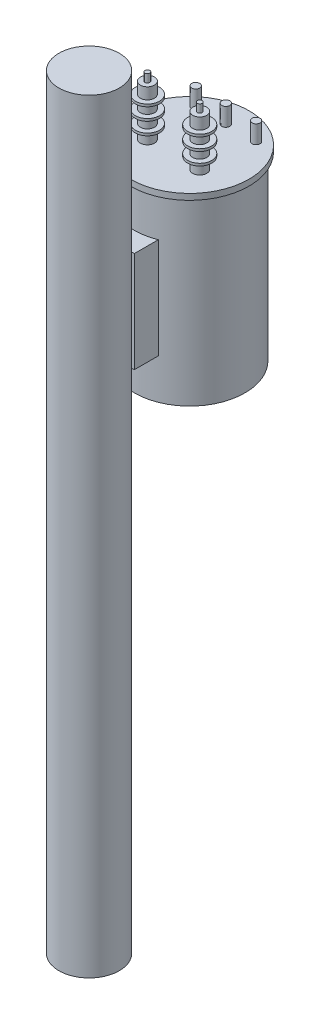
from build123d import *

# Parameters (mm, degrees)
SKETCH1_R           = 275
TANK_DEPTH          = 900
LID_START           = 900
SKETCH2_R           = 295
LID_DEPTH           = 30
POLE_START          = -2300
SKETCH3_R           = 150
POLE_DEPTH          = 3800
BUSHING_START       = 930
SKETCH4_R           = 35
BUSHING_HV_1_DEPTH  = 250
SHED_START          = 986.5
SKETCH5_R           = 60
SHED_HV_1_1_DEPTH   = 12
SHED_START_2        = 1049
SKETCH6_R           = 60
SHED_HV_1_2_DEPTH   = 12
SHED_START_3        = 1111.5
SKETCH7_R           = 60
SHED_HV_1_3_DEPTH   = 12
TERMINAL_START      = 1180
SKETCH8_R           = 12
TERMINAL_HV_1_DEPTH = 40
SKETCH9_R           = 35
BUSHING_HV_2_DEPTH  = 250
SKETCH10_R          = 60
SHED_HV_2_1_DEPTH   = 12
SKETCH11_R          = 60
SHED_HV_2_2_DEPTH   = 12
SKETCH12_R          = 60
SHED_HV_2_3_DEPTH   = 12
SKETCH13_R          = 12
TERMINAL_HV_2_DEPTH = 40
LV_START            = 930
SKETCH14_R          = 20
LV_BUSHING_1_DEPTH  = 90
SKETCH15_R          = 20
LV_BUSHING_2_DEPTH  = 90
SKETCH16_R          = 20
LV_BUSHING_3_DEPTH  = 90
HANGER_START        = 200
SKETCH17_W          = 200
SKETCH17_H          = 125
HANGER_DEPTH        = 500


with BuildPart() as part:
    # Sketch1 → Tank (new body)
    with BuildSketch(Plane(origin=(0, 0, 0), x_dir=(1, 0, 0), z_dir=(0, 1, 0))):
        with Locations(Location((0, 0, 0), (0, 0, 270))):
            Circle(SKETCH1_R)
    extrude(amount=TANK_DEPTH)


with BuildPart() as body_2:
    # Sketch2 → Lid (new body)
    with BuildSketch(Plane(origin=(0, 0, 0), x_dir=(1, 0, 0), z_dir=(0, 1, 0)).offset(LID_START)):
        with Locations(Location((0, 0, 0), (0, 0, 270))):
            Circle(SKETCH2_R)
    extrude(amount=LID_DEPTH)


with BuildPart() as body_3:
    # Sketch3 → Pole (new body)
    with BuildSketch(Plane(origin=(0, 0, 0), x_dir=(1, 0, 0), z_dir=(0, 1, 0)).offset(POLE_START)):
        with Locations(Location((0, -500, 0), (0, 0, 90))):
            Circle(SKETCH3_R)
    extrude(amount=POLE_DEPTH)


with BuildPart() as body_4:
    # Sketch4 → Bushing HV 1 (new body)
    with BuildSketch(Plane(origin=(0, 0, 0), x_dir=(1, 0, 0), z_dir=(0, 1, 0)).offset(BUSHING_START)):
        with Locations(Location((-130, -80, 0), (0, 0, 270))):
            Circle(SKETCH4_R)
    extrude(amount=BUSHING_HV_1_DEPTH)


with BuildPart() as body_5:
    # Sketch5 → Shed HV 1 1 (new body)
    with BuildSketch(Plane(origin=(0, 0, 0), x_dir=(1, 0, 0), z_dir=(0, 1, 0)).offset(SHED_START)):
        with Locations(Location((-130, -80, 0), (0, 0, 270))):
            Circle(SKETCH5_R)
    extrude(amount=SHED_HV_1_1_DEPTH)


with BuildPart() as body_6:
    # Sketch6 → Shed HV 1 2 (new body)
    with BuildSketch(Plane(origin=(0, 0, 0), x_dir=(1, 0, 0), z_dir=(0, 1, 0)).offset(SHED_START_2)):
        with Locations(Location((-130, -80, 0), (0, 0, 270))):
            Circle(SKETCH6_R)
    extrude(amount=SHED_HV_1_2_DEPTH)


with BuildPart() as body_7:
    # Sketch7 → Shed HV 1 3 (new body)
    with BuildSketch(Plane(origin=(0, 0, 0), x_dir=(1, 0, 0), z_dir=(0, 1, 0)).offset(SHED_START_3)):
        with Locations(Location((-130, -80, 0), (0, 0, 270))):
            Circle(SKETCH7_R)
    extrude(amount=SHED_HV_1_3_DEPTH)


with BuildPart() as body_8:
    # Sketch8 → Terminal HV 1 (new body)
    with BuildSketch(Plane(origin=(0, 0, 0), x_dir=(1, 0, 0), z_dir=(0, 1, 0)).offset(TERMINAL_START)):
        with Locations(Location((-130, -80, 0), (0, 0, 270))):
            Circle(SKETCH8_R)
    extrude(amount=TERMINAL_HV_1_DEPTH)


with BuildPart() as body_9:
    # Sketch9 → Bushing HV 2 (new body)
    with BuildSketch(Plane(origin=(0, 0, 0), x_dir=(1, 0, 0), z_dir=(0, 1, 0)).offset(BUSHING_START)):
        with Locations(Location((130, -80, 0), (0, 0, 270))):
            Circle(SKETCH9_R)
    extrude(amount=BUSHING_HV_2_DEPTH)


with BuildPart() as body_10:
    # Sketch10 → Shed HV 2 1 (new body)
    with BuildSketch(Plane(origin=(0, 0, 0), x_dir=(1, 0, 0), z_dir=(0, 1, 0)).offset(SHED_START)):
        with Locations(Location((130, -80, 0), (0, 0, 270))):
            Circle(SKETCH10_R)
    extrude(amount=SHED_HV_2_1_DEPTH)


with BuildPart() as body_11:
    # Sketch11 → Shed HV 2 2 (new body)
    with BuildSketch(Plane(origin=(0, 0, 0), x_dir=(1, 0, 0), z_dir=(0, 1, 0)).offset(SHED_START_2)):
        with Locations(Location((130, -80, 0), (0, 0, 270))):
            Circle(SKETCH11_R)
    extrude(amount=SHED_HV_2_2_DEPTH)


with BuildPart() as body_12:
    # Sketch12 → Shed HV 2 3 (new body)
    with BuildSketch(Plane(origin=(0, 0, 0), x_dir=(1, 0, 0), z_dir=(0, 1, 0)).offset(SHED_START_3)):
        with Locations(Location((130, -80, 0), (0, 0, 270))):
            Circle(SKETCH12_R)
    extrude(amount=SHED_HV_2_3_DEPTH)


with BuildPart() as body_13:
    # Sketch13 → Terminal HV 2 (new body)
    with BuildSketch(Plane(origin=(0, 0, 0), x_dir=(1, 0, 0), z_dir=(0, 1, 0)).offset(TERMINAL_START)):
        with Locations(Location((130, -80, 0), (0, 0, 270))):
            Circle(SKETCH13_R)
    extrude(amount=TERMINAL_HV_2_DEPTH)


with BuildPart() as body_14:
    # Sketch14 → LV bushing 1 (new body)
    with BuildSketch(Plane(origin=(0, 0, 0), x_dir=(1, 0, 0), z_dir=(0, 1, 0)).offset(LV_START)):
        with Locations(Location((-150, 180, 0), (0, 0, 90))):
            Circle(SKETCH14_R)
    extrude(amount=LV_BUSHING_1_DEPTH)


with BuildPart() as body_15:
    # Sketch15 → LV bushing 2 (new body)
    with BuildSketch(Plane(origin=(0, 0, 0), x_dir=(1, 0, 0), z_dir=(0, 1, 0)).offset(LV_START)):
        with Locations(Location((0, 180, 0), (0, 0, 90))):
            Circle(SKETCH15_R)
    extrude(amount=LV_BUSHING_2_DEPTH)


with BuildPart() as body_16:
    # Sketch16 → LV bushing 3 (new body)
    with BuildSketch(Plane(origin=(0, 0, 0), x_dir=(1, 0, 0), z_dir=(0, 1, 0)).offset(LV_START)):
        with Locations(Location((150, 180, 0), (0, 0, 90))):
            Circle(SKETCH16_R)
    extrude(amount=LV_BUSHING_3_DEPTH)


with BuildPart() as body_17:
    # Sketch17 → Hanger (new body)
    with BuildSketch(Plane(origin=(0, 0, 0), x_dir=(1, 0, 0), z_dir=(0, 1, 0)).offset(HANGER_START)):
        with Locations((0, -312.5)):
            Rectangle(SKETCH17_W, SKETCH17_H)
    extrude(amount=HANGER_DEPTH)


solid = Compound([part.part, body_2.part, body_3.part, body_4.part, body_5.part, body_6.part, body_7.part, body_8.part, body_9.part, body_10.part, body_11.part, body_12.part, body_13.part, body_14.part, body_15.part, body_16.part, body_17.part])
